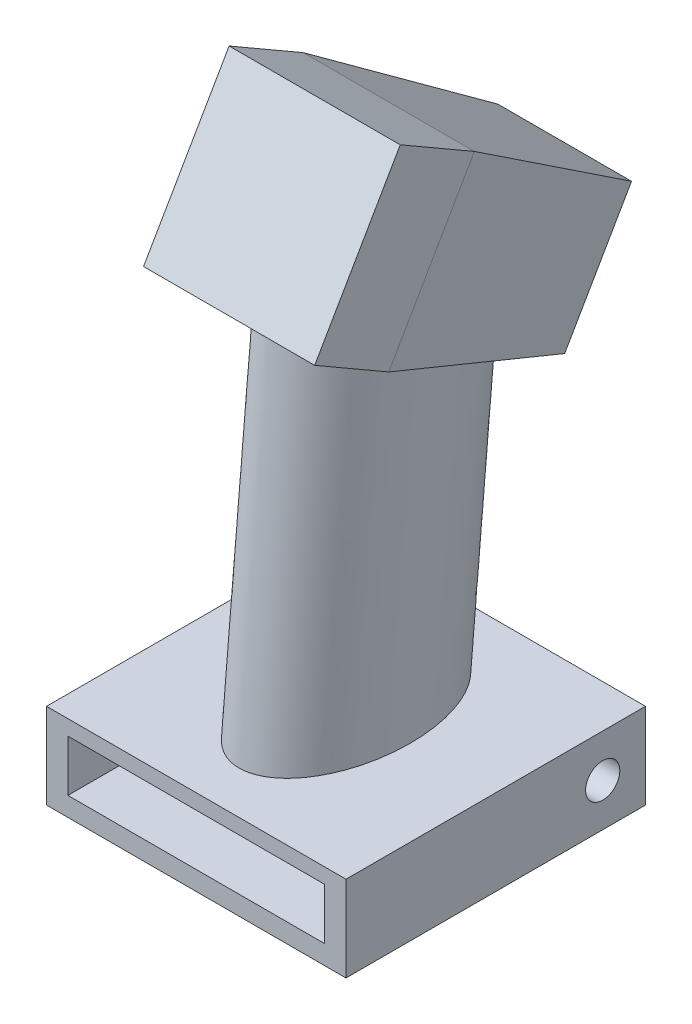
from build123d import *

# Parameters (mm, degrees)
SKETCH2_RX                    = 25
SKETCH2_RY                    = 15
SKETCH2_RX_2                  = 22.5
SKETCH2_RY_2                  = 12.5
BOSS_EXTRUDE1_DEPTH           = 100
SKETCH8_W                     = 40
SKETCH8_H                     = 40
BOSS_EXTRUDE2_DEPTH           = 20
BOSS_EXTRUDE2_OTHER_WAY_DEPTH = 50
BOSS_EXTRUDE2_OTHER_WAY_TAPER = 5
SKETCH9_W                     = 70
SKETCH9_H                     = 70
BOSS_EXTRUDE3_DEPTH           = 20
SKETCH10_W                    = 60
SKETCH10_H                    = 12
CUT_EXTRUDE1_DEPTH            = 55
CUT_EXTRUDE2_DEPTH            = 155.023239358
CUT_EXTRUDE2_DEPTH_BACK       = 155.023239358
SKETCH11_R                    = 1.75
SKETCH13_R                    = 4
CUT_EXTRUDE3_DEPTH            = 5
CUT_EXTRUDE4_START            = -10
SKETCH14_R                    = 4
CUT_EXTRUDE4_DEPTH            = 10


with BuildPart() as part:
    # Sketch2 → Boss-Extrude1 (new, along a direction that is not the sketch's normal)
    with BuildSketch(Plane(origin=(0, 0, 0), x_dir=(1, 0, 0), z_dir=(0, 1, 0))):
        with Locations(Location((0, 0), (0, 0, -90))):
            Ellipse(SKETCH2_RX, SKETCH2_RY)
        with Locations(Location((0, 0), (0, 0, 90))):
            Ellipse(SKETCH2_RX_2, SKETCH2_RY_2, mode=Mode.SUBTRACT)
    extrude(amount=BOSS_EXTRUDE1_DEPTH, dir=(0, 0.9961946980917453, -0.08715574274766182))

    # Sketch8 → Boss-Extrude2 (add)
    with BuildSketch(Plane(origin=(0, 25, 43.301270189), x_dir=(-1, 0, 0), z_dir=(0, -0.5000000000000041, -0.8660254037844364))):
        with Locations((0, 86.602540378)):
            Rectangle(SKETCH8_W, SKETCH8_H)
    extrude(amount=-BOSS_EXTRUDE2_DEPTH)

    # Sketch8 → Boss-Extrude2 other way (add)
    with BuildSketch(Plane(origin=(0, 25, 43.301270189), x_dir=(-1, 0, 0), z_dir=(0, -0.5000000000000041, -0.8660254037844364))):
        with Locations((0, 86.602540378)):
            Rectangle(SKETCH8_W, SKETCH8_H)
    extrude(amount=BOSS_EXTRUDE2_OTHER_WAY_DEPTH, taper=BOSS_EXTRUDE2_OTHER_WAY_TAPER)

    # Sketch9 → Boss-Extrude3 (add)
    with BuildSketch(Plane(origin=(0, 0, 0), x_dir=(-1, 0, 0), z_dir=(0, -1, 0))):
        Rectangle(SKETCH9_W, SKETCH9_H)
    extrude(amount=BOSS_EXTRUDE3_DEPTH)

    # Sketch10 → Cut-Extrude1 (cut)
    with BuildSketch(Plane.XY.offset(35)):
        with Locations((0, -9.537809852)):
            Rectangle(SKETCH10_W, SKETCH10_H)
    extrude(amount=-CUT_EXTRUDE1_DEPTH, mode=Mode.SUBTRACT)

    # Sketch11 → Cut-Extrude2 (cut, two sides: drawn at the far end of the back side and taken through both)
    with BuildSketch(Plane(origin=(35, 0, 0), x_dir=(0, 0, -1), z_dir=(1, 0, 0)).offset(-CUT_EXTRUDE2_DEPTH_BACK)):
        with Locations((25, -10)):
            Circle(SKETCH11_R)
    extrude(amount=CUT_EXTRUDE2_DEPTH + CUT_EXTRUDE2_DEPTH_BACK, mode=Mode.SUBTRACT)

    # Sketch13 → Cut-Extrude3 (cut)
    with BuildSketch(Plane.ZY.offset(35)):
        with Locations((-25, -10)):
            Circle(SKETCH13_R)
    extrude(amount=-CUT_EXTRUDE3_DEPTH, mode=Mode.SUBTRACT)

    # Sketch14 → Cut-Extrude4 (cut)
    with BuildSketch(Plane(origin=(35, 0, 0), x_dir=(0, 0, -1), z_dir=(1, 0, 0)).offset(CUT_EXTRUDE4_START)):
        with Locations((25, -10)):
            Circle(SKETCH14_R)
    extrude(amount=CUT_EXTRUDE4_DEPTH, mode=Mode.SUBTRACT)


solid = part.part
